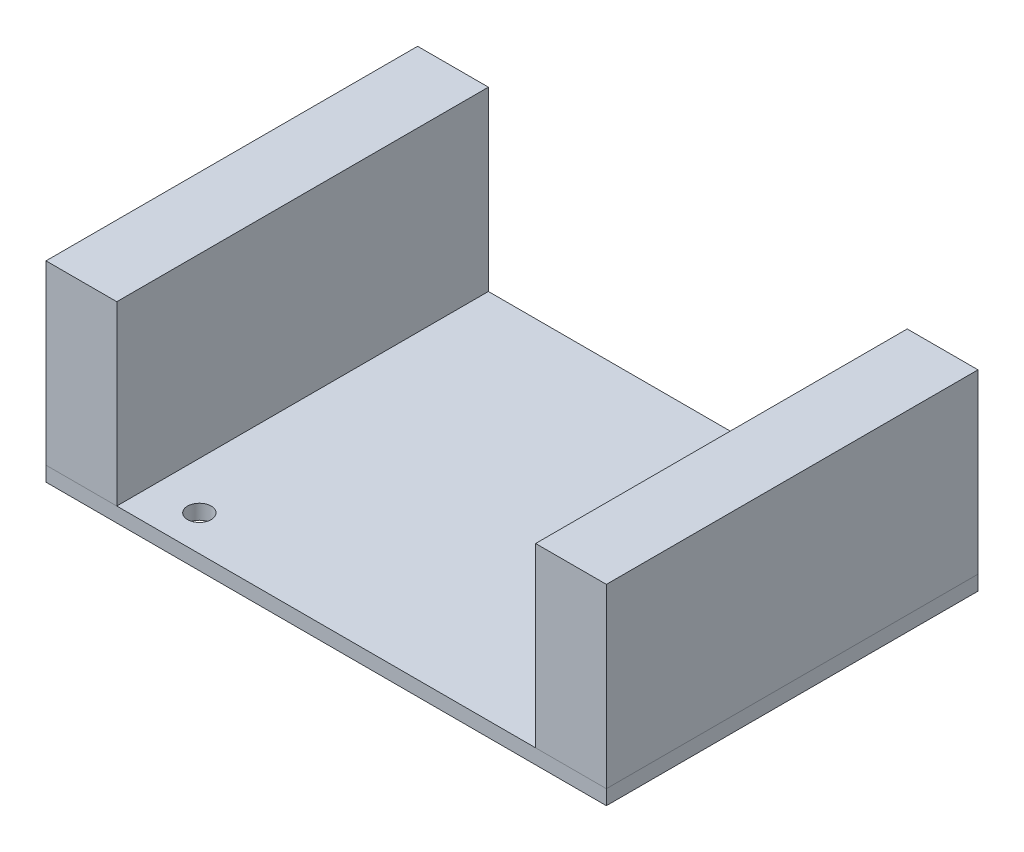
from build123d import *

# Parameters (mm, degrees)
SKETCH1_W             = 47.5
SKETCH1_H             = 31.5
SKETCH1_R             = 1
BOSS_EXTRUDE1_DEPTH   = 1.25
SKETCH2_W             = 6
SKETCH2_H             = 31.5
BOSS_EXTRUDE2_DEPTH   = 15
BOSS_EXTRUDE2_2_DEPTH = 15


with BuildPart() as part:
    # Sketch1 → Boss-Extrude1 (new body)
    with BuildSketch(Plane(origin=(0, 0, 0), x_dir=(1, 0, 0), z_dir=(0, 1, 0))):
        Rectangle(SKETCH1_W, SKETCH1_H)
        with Locations(Location((13.75, 12.75, 0), (0, 0, 270))):
            Circle(SKETCH1_R, mode=Mode.SUBTRACT)
        with Locations(Location((-13.75, -12.75, 0), (0, 0, 270))):
            Circle(SKETCH1_R, mode=Mode.SUBTRACT)
    extrude(amount=BOSS_EXTRUDE1_DEPTH)


with BuildPart() as body_2:
    # Sketch2 → Boss-Extrude2 (new body)
    with BuildSketch(Plane(origin=(0, 1.25, 0), x_dir=(1, 0, 0), z_dir=(0, 1, 0))):
        with Locations((-20.75, 0)):
            Rectangle(SKETCH2_W, SKETCH2_H)
    extrude(amount=BOSS_EXTRUDE2_DEPTH)


with BuildPart() as body_3:
    # Sketch2 → Boss-Extrude2 2 (new body)
    with BuildSketch(Plane(origin=(0, 1.25, 0), x_dir=(1, 0, 0), z_dir=(0, 1, 0))):
        with Locations((20.75, 0)):
            Rectangle(SKETCH2_W, SKETCH2_H)
    extrude(amount=BOSS_EXTRUDE2_2_DEPTH)


solid = Compound([part.part, body_2.part, body_3.part])
